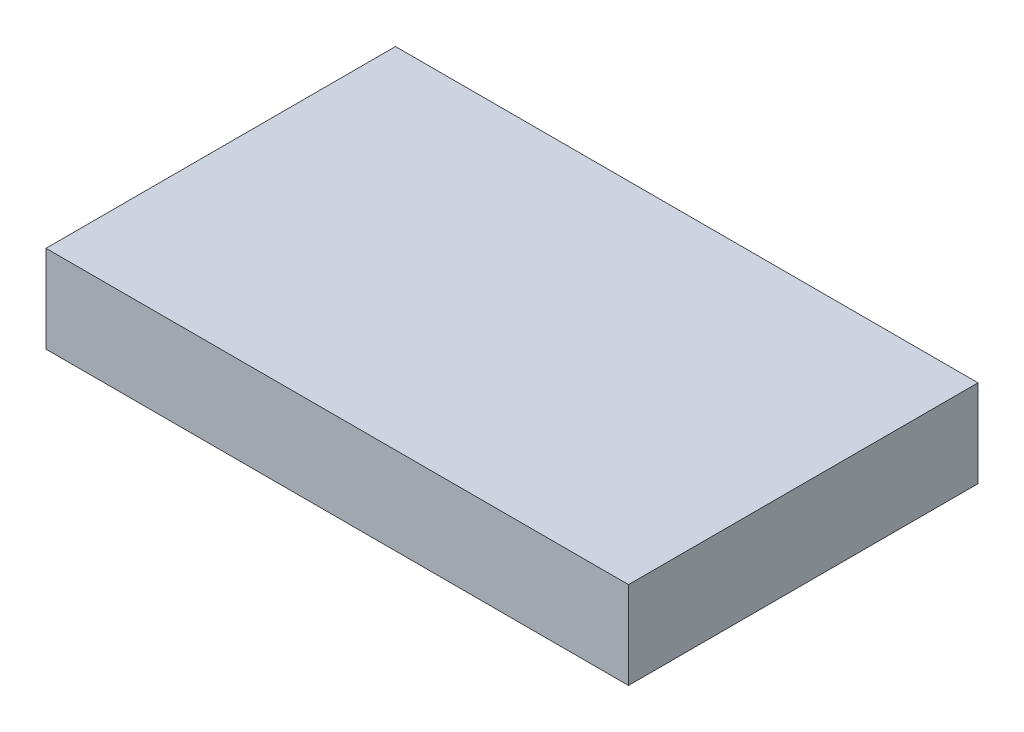
from build123d import *

# Parameters (mm, degrees)
SKETCH_1_W      = 80
SKETCH_1_H      = 12
EXTRUDE_1_DEPTH = 48


with BuildPart() as part:
    # 草图1 → 凸台-拉伸1 (new body)
    with BuildSketch(Plane.XY):
        with Locations((0, 6)):
            Rectangle(SKETCH_1_W, SKETCH_1_H)
    extrude(amount=EXTRUDE_1_DEPTH)


solid = part.part
